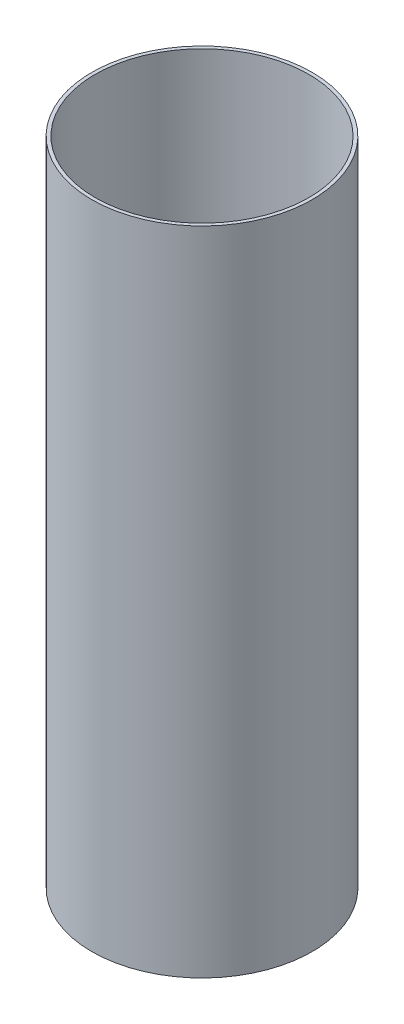
from build123d import *

# Parameters (mm, degrees)
SZKIC1_W = 2
SZKIC1_H = 384


with BuildPart() as part:
    # Szkic1 → Obrót1 (revolve)
    with BuildSketch(Plane.XY, mode=Mode.PRIVATE) as obr_t1_sk:
        with Locations((64, 0)):
            Rectangle(SZKIC1_W, SZKIC1_H)
    revolve(obr_t1_sk.sketch.rotate(Axis((0, 150, 0), (0, -1, 0)), 90), axis=Axis((0, 150, 0), (0, -1, 0)))


solid = part.part
